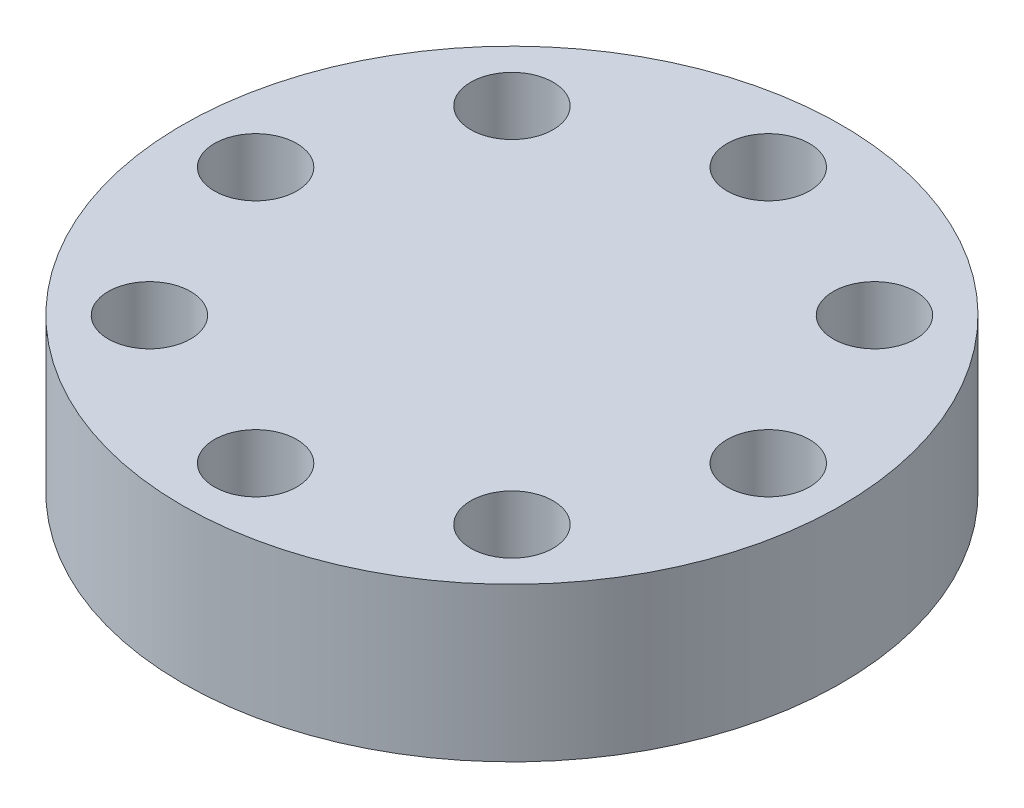
from build123d import *

# Parameters (mm, degrees)
SKETCH1_R                = 9
BRACKETMOUNT_DEPTH       = 4.2
SKETCH2_R                = 1.125
BRACKET_MOUNTHOLES_DEPTH = 4.2
SKETCH3_R                = 3
AXLEHOLE_DEPTH           = 3.7


with BuildPart() as part:
    # Sketch1 → BracketMount (new body)
    with BuildSketch(Plane(origin=(0, 0, 0), x_dir=(1, 0, 0), z_dir=(0, 1, 0))):
        with Locations(Location((0, 0, 0), (0, 0, 270))):
            Circle(SKETCH1_R)
    extrude(amount=BRACKETMOUNT_DEPTH)

    # Sketch2 → Bracket-MountHoles (cut)
    with BuildSketch(Plane(origin=(0, 4.2, 0), x_dir=(1, 0, 0), z_dir=(0, 1, 0))):
        with Locations(Location((0, 7, 0), (0, 0, 270))):
            Circle(SKETCH2_R)
        with Locations(Location((4.949747468, 4.949747468, 0), (0, 0, 270))):
            Circle(SKETCH2_R)
        with Locations(Location((7, 0, 0), (0, 0, 270))):
            Circle(SKETCH2_R)
        with Locations(Location((4.949747468, -4.949747468, 0), (0, 0, 270))):
            Circle(SKETCH2_R)
        with Locations(Location((0, -7, 0), (0, 0, 270))):
            Circle(SKETCH2_R)
        with Locations(Location((-4.949747468, -4.949747468, 0), (0, 0, 270))):
            Circle(SKETCH2_R)
        with Locations(Location((-7, 0, 0), (0, 0, 270))):
            Circle(SKETCH2_R)
        with Locations(Location((-4.949747468, 4.949747468, 0), (0, 0, 270))):
            Circle(SKETCH2_R)
    extrude(amount=-BRACKET_MOUNTHOLES_DEPTH, mode=Mode.SUBTRACT)

    # Sketch3 → AxleHole (cut)
    with BuildSketch(Plane.XZ):
        with Locations(Location((0, 0, 0), (0, 0, 270))):
            Circle(SKETCH3_R)
    extrude(amount=-AXLEHOLE_DEPTH, mode=Mode.SUBTRACT)


solid = part.part
